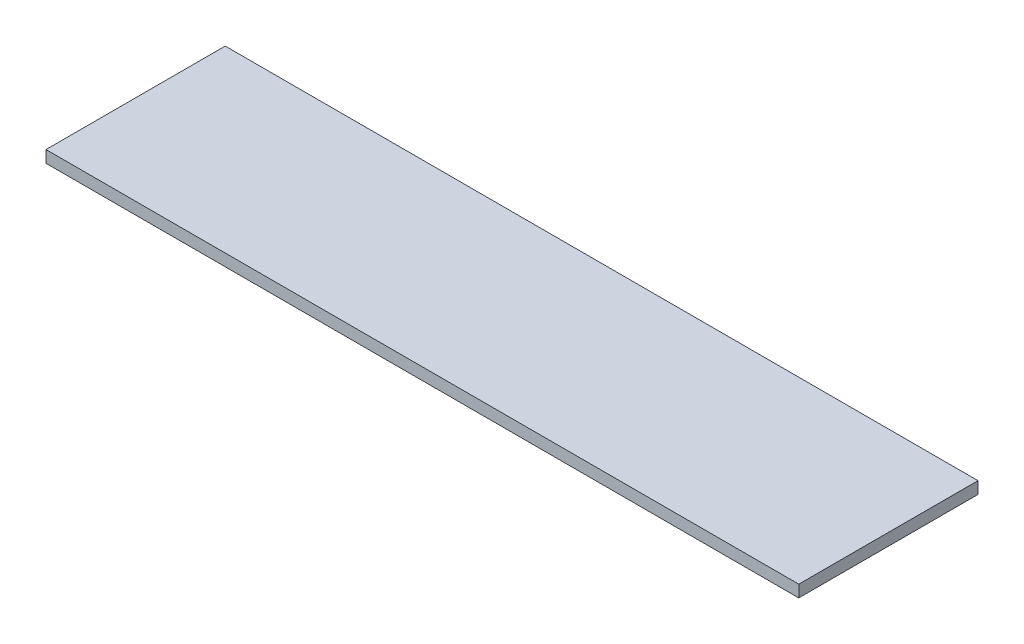
from build123d import *

# Parameters (mm, degrees)
SKETCH2_W           = 800.1
SKETCH2_H           = 190.5
BOSS_EXTRUDE2_DEPTH = 12.7


with BuildPart() as part:
    # Sketch2 → Boss-Extrude2 (new body)
    with BuildSketch(Plane(origin=(0, 0, 0), x_dir=(1, 0, 0), z_dir=(0, 1, 0))):
        with Locations((400.05, 95.25)):
            Rectangle(SKETCH2_W, SKETCH2_H)
    extrude(amount=BOSS_EXTRUDE2_DEPTH)


solid = part.part
